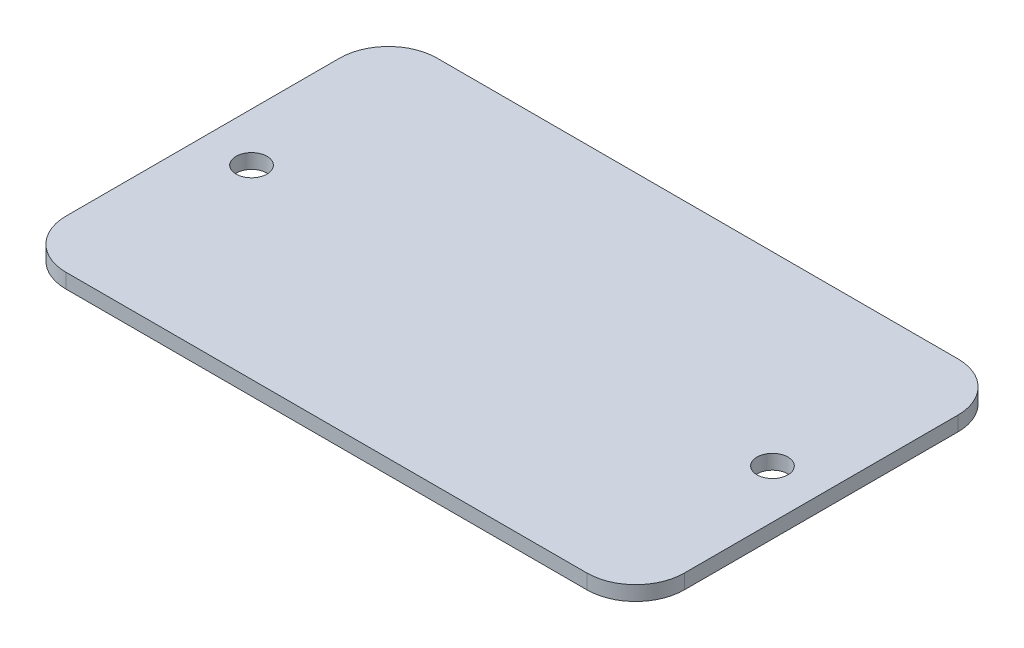
from build123d import *

# Parameters (mm, degrees)
BOSS_EXTRUDE1_DEPTH = 3
SKETCH2_R           = 3.175
CUT_EXTRUDE1_DEPTH  = 3


with BuildPart() as part:
    # Sketch1 → Boss-Extrude1 (new body)
    with BuildSketch(Plane(origin=(0, 0, 0), x_dir=(1, 0, 0), z_dir=(0, 1, 0))):
        with BuildLine():
            Line((-53.5, -38.1), (53.5, -38.1))
            ThreePointArc((53.5, -38.1), (60.571067812, -35.171067812), (63.5, -28.1))
            Line((63.5, -28.1), (63.5, 28.1))
            ThreePointArc((63.5, 28.1), (60.571067812, 35.171067812), (53.5, 38.1))
            Line((53.5, 38.1), (-53.5, 38.1))
            ThreePointArc((-53.5, 38.1), (-60.571067812, 35.171067812), (-63.5, 28.1))
            Line((-63.5, 28.1), (-63.5, -28.1))
            ThreePointArc((-63.5, -28.1), (-60.571067812, -35.171067812), (-53.5, -38.1))
        make_face()
    extrude(amount=BOSS_EXTRUDE1_DEPTH)

    # Sketch2 → Cut-Extrude1 (cut)
    with BuildSketch(Plane(origin=(0, 3, 0), x_dir=(1, 0, 0), z_dir=(0, 1, 0))):
        with Locations(Location((-53.5, 0, 0), (0, 0, 270))):
            Circle(SKETCH2_R)
        with Locations(Location((53.5, 0, 0), (0, 0, 270))):
            Circle(SKETCH2_R)
    extrude(amount=-CUT_EXTRUDE1_DEPTH, mode=Mode.SUBTRACT)


solid = part.part
